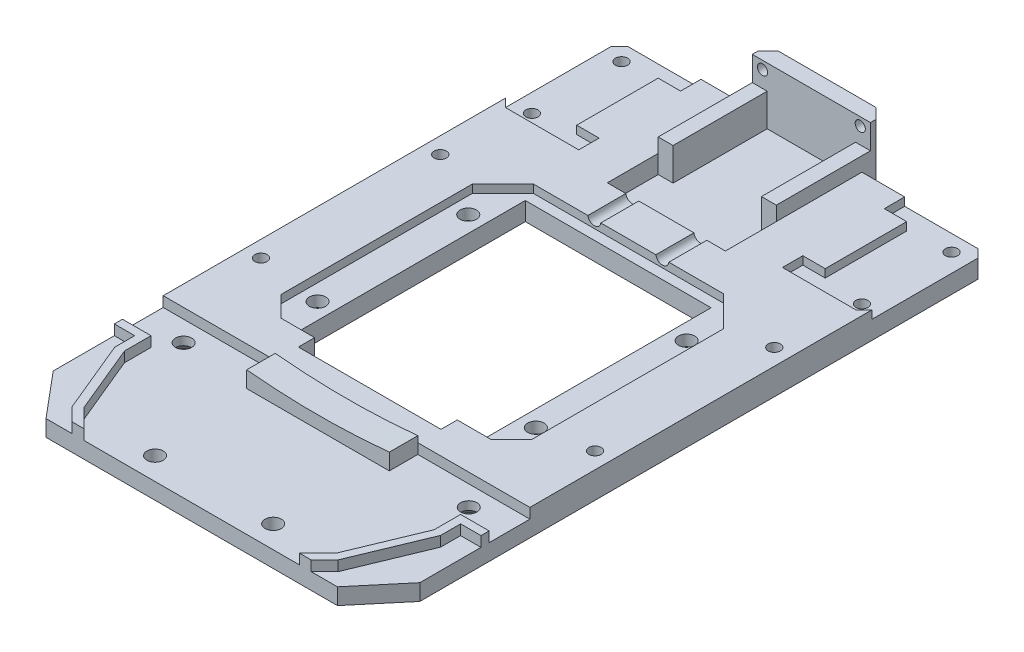
from build123d import *
from OCP.BRepFilletAPI import BRepFilletAPI_MakeChamfer

# Parameters (mm, degrees)
SKETCH1_W                                       = 90
SKETCH1_H                                       = 150
BOSS_EXTRUDE1_DEPTH                             = 6.5
CSK_FOR_M4_FLAT_HEAD_MACHINE_SCREW1_D           = 4
CSK_FOR_M4_FLAT_HEAD_MACHINE_SCREW1_DEPTH       = 38.798278762
CSK_FOR_M4_FLAT_HEAD_MACHINE_SCREW1_CSINK_D     = 7.9
CSK_FOR_M4_FLAT_HEAD_MACHINE_SCREW1_CSINK_ANGLE = 90
CSK_FOR_M4_FLAT_HEAD_MACHINE_SCREW1_TIP         = 1.201721238
SKETCH7_W                                       = 21.7
SKETCH7_H                                       = 24.512560893
CUT_EXTRUDE4_DEPTH                              = 4.5
CUT_EXTRUDE8_DEPTH                              = 88.705473033
CUT_EXTRUDE8_DEPTH_BACK                         = 88.705473033
CUT_EXTRUDE9_DEPTH                              = 88.705473033
CUT_EXTRUDE9_DEPTH_BACK                         = 88.705473033
SKETCH12_W                                      = 45.6
SKETCH12_H                                      = 57
CUT_EXTRUDE11_DEPTH                             = 88.705473033
CUT_EXTRUDE11_DEPTH_BACK                        = 2
CUT_EXTRUDE12_DEPTH                             = 2.5
CSK_FOR_M4_SFHCS1_AT_2_COUNT                    = 2
CSK_FOR_M4_SFHCS1_AT_2_PITCH                    = 37
CSK_FOR_M4_SFHCS1_AT_3_COUNT                    = 2
CSK_FOR_M4_SFHCS1_AT_3_PITCH                    = 65.130330876
CSK_FOR_M4_SFHCS1_AT_4_COUNT                    = 2
CSK_FOR_M4_SFHCS1_AT_4_PITCH                    = 53.6
SKETCH17_W                                      = 35
SKETCH17_H                                      = 7
BOSS_EXTRUDE2_DEPTH                             = 4
CUT_EXTRUDE13_DEPTH                             = 88.705473033
CUT_EXTRUDE13_DEPTH_BACK                        = 88.705473033
SKETCH18_W                                      = 35
SKETCH18_H                                      = 4
CUT_EXTRUDE14_DEPTH                             = 2
CSK_FOR_M3_SFHCS1_AT_2_COUNT                    = 2
CSK_FOR_M3_SFHCS1_AT_2_PITCH                    = 22
CSK_FOR_M3_SFHCS1_AT_3_COUNT                    = 2
CSK_FOR_M3_SFHCS1_AT_3_PITCH                    = 83.934498271
CSK_FOR_M3_SFHCS1_AT_4_COUNT                    = 2
CSK_FOR_M3_SFHCS1_AT_4_PITCH                    = 81
CSK_FOR_M3_SFHCS2_AT_2_COUNT                    = 2
CSK_FOR_M3_SFHCS2_AT_2_PITCH                    = 44
CSK_FOR_M3_SFHCS2_AT_3_COUNT                    = 2
CSK_FOR_M3_SFHCS2_AT_3_PITCH                    = 82
CSK_FOR_M3_SFHCS2_AT_4_COUNT                    = 2
CSK_FOR_M3_SFHCS2_AT_4_PITCH                    = 93.059120993
SKETCH24_W                                      = 29
SKETCH24_H                                      = 4.5
CUT_EXTRUDE15_DEPTH                             = 2
CSK_FOR_M4_SFHCS2_AT_2_COUNT                    = 2
CSK_FOR_M4_SFHCS2_AT_2_PITCH                    = 29
CHAMFER1_SIZE                                   = 2
SKETCH27_W                                      = 29
SKETCH27_H                                      = 12
BOSS_EXTRUDE3_DEPTH                             = 2
SKETCH28_W                                      = 3.65
SKETCH28_H                                      = 8
SKETCH28_H_2                                    = 2
BOSS_EXTRUDE4_DEPTH                             = 21
SKETCH29_R                                      = 1.6
CUT_EXTRUDE16_DEPTH                             = 9.323922895
BOSS_EXTRUDE5_DEPTH                             = 1
BOSS_EXTRUDE9_DEPTH                             = 1.5
BOSS_EXTRUDE10_DEPTH                            = 5
SKETCH36_W                                      = 21.7
SKETCH36_H                                      = 3.9
BOSS_EXTRUDE11_DEPTH                            = 8
CHAMFER4_SIZE                                   = 2.5
BOSS_EXTRUDE12_DEPTH                            = 6
F_1_0MM_DOWEL_HOLE1_D                           = 2.5
F_1_0MM_DOWEL_HOLE1_DEPTH                       = 5
F_1_0MM_DOWEL_HOLE1_TIP                         = 0.751075774
CHAMFER5_SIZE                                   = 11
CHAMFER5_SIZE2                                  = 9.230095943
CUT_EXTRUDE19_DEPTH                             = 9.5
CUT_EXTRUDE18_DEPTH                             = 14


with BuildPart() as part:
    # Sketch1 → Boss-Extrude1 (new body)
    with BuildSketch(Plane(origin=(0, 0, 0), x_dir=(1, 0, 0), z_dir=(0, 1, 0))):
        Rectangle(SKETCH1_W, SKETCH1_H)
    extrude(amount=BOSS_EXTRUDE1_DEPTH)

    # CSK for M4 Flat Head Machine Screw1
    with Locations(Plane(origin=(-695.683007616, 0, -1338.247292614), x_dir=(-1, 0, 0), z_dir=(0, -1, 0))):
        with Locations((-730.683007616, -1380.247292614), (-660.683007616, -1380.247292614)):
            CounterSinkHole(CSK_FOR_M4_FLAT_HEAD_MACHINE_SCREW1_D / 2, CSK_FOR_M4_FLAT_HEAD_MACHINE_SCREW1_CSINK_D / 2, depth=CSK_FOR_M4_FLAT_HEAD_MACHINE_SCREW1_DEPTH, counter_sink_angle=CSK_FOR_M4_FLAT_HEAD_MACHINE_SCREW1_CSINK_ANGLE)
            with Locations((0, 0, -(CSK_FOR_M4_FLAT_HEAD_MACHINE_SCREW1_DEPTH + CSK_FOR_M4_FLAT_HEAD_MACHINE_SCREW1_TIP / 2))):  # 118° drill point
                Cone(0, CSK_FOR_M4_FLAT_HEAD_MACHINE_SCREW1_D / 2, CSK_FOR_M4_FLAT_HEAD_MACHINE_SCREW1_TIP, mode=Mode.SUBTRACT)

    # Sketch7 → Cut-Extrude4 (cut)
    with BuildSketch(Plane(origin=(0, 6.5, 0), x_dir=(1, 0, 0), z_dir=(0, 1, 0))):
        with Locations((0, 62.743719554)):
            Rectangle(SKETCH7_W, SKETCH7_H)
    extrude(amount=-CUT_EXTRUDE4_DEPTH, mode=Mode.SUBTRACT)

    # Sketch11 → Cut-Extrude8 (cut, two sides: drawn at the far end of the back side and taken through both)
    with BuildSketch(Plane(origin=(0, 6.5, 0), x_dir=(1, 0, 0), z_dir=(0, 1, 0)).offset(-CUT_EXTRUDE8_DEPTH_BACK)):
        Polygon((-10.85, 75), (-14.5, 75), (-14.5, 42), (14.5, 42), (14.5, 75), (10.85, 75), (10.85, 50.487439107), (-10.85, 50.487439107), align=None)
    extrude(amount=CUT_EXTRUDE8_DEPTH + CUT_EXTRUDE8_DEPTH_BACK, mode=Mode.SUBTRACT)


with BuildPart() as cut_extrude8_piece_1:
    # of the separate pieces the step leaves, piece 1, a body of its own (cut_extrude8_pieces)
    add(part.part.solids().sort_by_distance((-45, 0, -75))[0])

    # Sketch12 → Cut-Extrude9 (cut, two sides: drawn at the far end of the back side and taken through both)
    with BuildSketch(Plane(origin=(0, 6.5, 0), x_dir=(1, 0, 0), z_dir=(0, 1, 0)).offset(-CUT_EXTRUDE9_DEPTH_BACK)):
        with Locations((0, 1.176077105)):
            Rectangle(SKETCH12_W, SKETCH12_H)
    extrude(amount=CUT_EXTRUDE9_DEPTH + CUT_EXTRUDE9_DEPTH_BACK, mode=Mode.SUBTRACT)

    # Sketch14 → Cut-Extrude11 (cut, two sides: drawn at the far end of the back side and taken through both)
    with BuildSketch(Plane(origin=(0, 6.5, 0), x_dir=(1, 0, 0), z_dir=(0, 1, 0)).offset(-CUT_EXTRUDE11_DEPTH_BACK)):
        Polygon((-22.8, -27.323922895), (-22.8, 29.676077105), (22.8, 29.676077105), (22.8, -27.323922895), (25.8, -27.323922895), (30.8, -22.323922895), (30.8, 24.676077105), (23.3, 32.176077105), (-23.3, 32.176077105), (-30.8, 24.676077105), (-30.8, -22.323922895), (-25.8, -27.323922895), align=None)
    extrude(amount=CUT_EXTRUDE11_DEPTH + CUT_EXTRUDE11_DEPTH_BACK, mode=Mode.SUBTRACT)

    # Sketch2 → Cut-Extrude12 (cut)
    with BuildSketch(Plane(origin=(0, 6.5, 0), x_dir=(1, 0, 0), z_dir=(0, 1, 0))):
        Polygon((-38, -47), (-45, -47), (-45, -37), (45, -37), (45, -47), (38, -47), (38, -53.5), (30.928932188, -70.571067812), (26.5, -75), (-26.5, -75), (-30.928932188, -70.571067812), (-38, -53.5), align=None)
        Polygon((-32.624450318, -71.703976807), (-29.328427125, -75), (-45, -75), (-45, -49), (-40, -49), (-40, -53.897824735), align=None)
        Polygon((29.328427125, -75), (32.624450318, -71.703976807), (40, -53.897824735), (40, -49), (45, -49), (45, -75), align=None)
    extrude(amount=-CUT_EXTRUDE12_DEPTH, mode=Mode.SUBTRACT)

    # Sketch16 → CSK for M4 SFHCS1 (revolve, cut)
    with BuildSketch(Plane(origin=(-26.8, 0, 17.323922895), x_dir=(0, 0, -1), z_dir=(1, 0, 0))):
        Polygon((0, 0), (0, 26.701721238), (2, 25.5), (2, 1.8), (3.8, 0), align=None)
    csk_for_m4_sfhcs1 = revolve(axis=Axis((-26.8, -6.35, 17.323922895), (0, 1, 0)), mode=Mode.SUBTRACT)

    # CSK for M4 SFHCS1 at 2: CSK for M4 SFHCS1 ×2
    with Locations(*[(0, 0, -i * CSK_FOR_M4_SFHCS1_AT_2_PITCH) for i in range(1, CSK_FOR_M4_SFHCS1_AT_2_COUNT)]):
        add(csk_for_m4_sfhcs1, mode=Mode.SUBTRACT)

    # CSK for M4 SFHCS1 at 3: CSK for M4 SFHCS1 ×2
    with Locations(*[Vector(0.8229652648649476, 0, -0.5680916940299047) * (i * CSK_FOR_M4_SFHCS1_AT_3_PITCH) for i in range(1, CSK_FOR_M4_SFHCS1_AT_3_COUNT)]):
        add(csk_for_m4_sfhcs1, mode=Mode.SUBTRACT)

    # CSK for M4 SFHCS1 at 4: CSK for M4 SFHCS1 ×2
    with Locations(*[(i * CSK_FOR_M4_SFHCS1_AT_4_PITCH, 0, 0) for i in range(1, CSK_FOR_M4_SFHCS1_AT_4_COUNT)]):
        add(csk_for_m4_sfhcs1, mode=Mode.SUBTRACT)

    # Sketch17 → Boss-Extrude2 (add)
    with BuildSketch(Plane(origin=(0, 4, 0), x_dir=(1, 0, 0), z_dir=(0, 1, 0))):
        with Locations((0, -40.5)):
            Rectangle(SKETCH17_W, SKETCH17_H)
    extrude(amount=BOSS_EXTRUDE2_DEPTH)

    # Sketch18 → Cut-Extrude13 (cut, two sides: drawn at the far end of the back side and taken through both)
    with BuildSketch(Plane(origin=(0, 6.5, 0), x_dir=(1, 0, 0), z_dir=(0, 1, 0)).offset(-CUT_EXTRUDE13_DEPTH_BACK)):
        with Locations((0, -29.323922895)):
            Rectangle(SKETCH18_W, SKETCH18_H)
    extrude(amount=CUT_EXTRUDE13_DEPTH + CUT_EXTRUDE13_DEPTH_BACK, mode=Mode.SUBTRACT)

    # Sketch19 → Cut-Extrude14 (cut)
    with BuildSketch(Plane(origin=(0, 6.5, 0), x_dir=(1, 0, 0), z_dir=(0, 1, 0))):
        Polygon((25, 70), (30.5, 70), (30.5, 50), (25, 50), (25, 45), (43, 45), (45, 47), (45, 75), (25, 75), align=None)
        Polygon((-25, 50), (-30.5, 50), (-30.5, 70), (-25, 70), (-25, 75), (-45, 75), (-45, 47), (-43, 45), (-25, 45), align=None)
    extrude(amount=-CUT_EXTRUDE14_DEPTH, mode=Mode.SUBTRACT)

    # Sketch21 → CSK for M3 SFHCS1 (revolve, cut)
    with BuildSketch(Plane(origin=(40.5, 0, -71), x_dir=(0, 0, -1), z_dir=(1, 0, 0))):
        Polygon((0, 0), (0, 5.901290929), (1.5, 5), (1.5, 1.86), (3.36, 0), align=None)
    csk_for_m3_sfhcs1 = revolve(axis=Axis((40.5, -6.35, -71), (0, 1, 0)), mode=Mode.SUBTRACT)

    # CSK for M3 SFHCS1 at 2: CSK for M3 SFHCS1 ×2
    with Locations(*[(0, 0, i * CSK_FOR_M3_SFHCS1_AT_2_PITCH) for i in range(1, CSK_FOR_M3_SFHCS1_AT_2_COUNT)]):
        add(csk_for_m3_sfhcs1, mode=Mode.SUBTRACT)

    # CSK for M3 SFHCS1 at 3: CSK for M3 SFHCS1 ×2
    with Locations(*[Vector(-0.9650382342013949, 0, 0.2621091500300089) * (i * CSK_FOR_M3_SFHCS1_AT_3_PITCH) for i in range(1, CSK_FOR_M3_SFHCS1_AT_3_COUNT)]):
        add(csk_for_m3_sfhcs1, mode=Mode.SUBTRACT)

    # CSK for M3 SFHCS1 at 4: CSK for M3 SFHCS1 ×2
    with Locations(*[(-i * CSK_FOR_M3_SFHCS1_AT_4_PITCH, 0, 0) for i in range(1, CSK_FOR_M3_SFHCS1_AT_4_COUNT)]):
        add(csk_for_m3_sfhcs1, mode=Mode.SUBTRACT)

    # Sketch23 → CSK for M3 SFHCS2 (revolve, cut)
    with BuildSketch(Plane(origin=(-41, 0, 17), x_dir=(0, 0, -1), z_dir=(1, 0, 0))):
        Polygon((0, 0), (0, 10.901290929), (1.5, 10), (1.5, 1.7), (3.2, 0), align=None)
    csk_for_m3_sfhcs2 = revolve(axis=Axis((-41, -6.35, 17), (0, 1, 0)), mode=Mode.SUBTRACT)

    # CSK for M3 SFHCS2 at 2: CSK for M3 SFHCS2 ×2
    with Locations(*[(0, 0, -i * CSK_FOR_M3_SFHCS2_AT_2_PITCH) for i in range(1, CSK_FOR_M3_SFHCS2_AT_2_COUNT)]):
        add(csk_for_m3_sfhcs2, mode=Mode.SUBTRACT)

    # CSK for M3 SFHCS2 at 3: CSK for M3 SFHCS2 ×2
    with Locations(*[(i * CSK_FOR_M3_SFHCS2_AT_3_PITCH, 0, 0) for i in range(1, CSK_FOR_M3_SFHCS2_AT_3_COUNT)]):
        add(csk_for_m3_sfhcs2, mode=Mode.SUBTRACT)

    # CSK for M3 SFHCS2 at 4: CSK for M3 SFHCS2 ×2
    with Locations(*[Vector(0.8811602680635651, 0, -0.4728177048146) * (i * CSK_FOR_M3_SFHCS2_AT_4_PITCH) for i in range(1, CSK_FOR_M3_SFHCS2_AT_4_COUNT)]):
        add(csk_for_m3_sfhcs2, mode=Mode.SUBTRACT)

    # Sketch24 → Cut-Extrude15 (cut)
    with BuildSketch(Plane(origin=(0, 0, -42), x_dir=(-1, 0, 0), z_dir=(0, 0, -1))):
        with Locations((0, 4.25)):
            Rectangle(SKETCH24_W, SKETCH24_H)
    extrude(amount=-CUT_EXTRUDE15_DEPTH, mode=Mode.SUBTRACT)

    # Sketch26 → CSK for M4 SFHCS2 (revolve, cut)
    with BuildSketch(Plane(origin=(-14.5, 11, 69.5), x_dir=(0, 0, 1), z_dir=(1, 0, 0))):
        Polygon((0, 0), (0, 12.201721238), (2, 11), (2, 1.8), (3.8, 0), align=None)
    csk_for_m4_sfhcs2 = revolve(axis=Axis((-14.5, 17.35, 69.5), (0, -1, 0)), mode=Mode.SUBTRACT)

    # CSK for M4 SFHCS2 at 2: CSK for M4 SFHCS2 ×2
    with Locations(*[(i * CSK_FOR_M4_SFHCS2_AT_2_PITCH, 0, 0) for i in range(1, CSK_FOR_M4_SFHCS2_AT_2_COUNT)]):
        add(csk_for_m4_sfhcs2, mode=Mode.SUBTRACT)

    # Chamfer1
    chamfer1_edges = [cut_extrude8_piece_1.edges().sort_by_distance(p)[0] for p in [
        (45, 2.25, -75),
        (-45, 2.25, -75),
    ]]
    chamfer(chamfer1_edges, length=CHAMFER1_SIZE)

    # Sketch27 → Boss-Extrude3 (add)
    with BuildSketch(Plane.XZ):
        with Locations((0, -48)):
            Rectangle(SKETCH27_W, SKETCH27_H)
    extrude(amount=-BOSS_EXTRUDE3_DEPTH)


with BuildPart() as cut_extrude8_piece_2:
    # of the separate pieces the step leaves, piece 2, a body of its own (cut_extrude8_pieces)
    add(part.part.solids().sort_by_distance((10.85, 0, -75))[0])

    # Combine1: union Cut-Extrude8 piece 1
    add(cut_extrude8_piece_1.part)

    # Sketch28 → Boss-Extrude4 (add)
    with BuildSketch(Plane(origin=(0, 0, -54), x_dir=(-1, 0, 0), z_dir=(0, 0, -1))):
        with Locations((-12.675, 6)):
            Rectangle(SKETCH28_W, SKETCH28_H)
        with Locations((12.675, 1)):
            Rectangle(SKETCH28_W, SKETCH28_H_2)
        with Locations((12.675, 6)):
            Rectangle(SKETCH28_W, SKETCH28_H)
        with Locations((-12.675, 1)):
            Rectangle(SKETCH28_W, SKETCH28_H_2)
    extrude(amount=BOSS_EXTRUDE4_DEPTH)

    # Sketch29 → Cut-Extrude16 (cut)
    with BuildSketch(Plane.XY.offset(-32.176077105)):
        with BuildLine():
            ThreePointArc((9.95, 6.7), (8.24980334, 8.296859615), (6.762549213, 6.5))
            Line((6.762549213, 6.5), (7.116103732, 6.5))
            ThreePointArc((7.116103732, 6.5), (8.249676361, 7.945967563), (9.6, 6.7))
            ThreePointArc((9.6, 6.7), (9.595967563, 6.599676361), (9.583896268, 6.5))
            Line((9.583896268, 6.5), (9.937450787, 6.5))
            ThreePointArc((9.937450787, 6.5), (9.946859615, 6.59980334), (9.95, 6.7))
        make_face()
        with BuildLine():
            Line((7.116103732, 6.5), (6.762549213, 6.5))
            ThreePointArc((6.762549213, 6.5), (8.35, 5.1), (9.937450787, 6.5))
            Line((9.937450787, 6.5), (9.583896268, 6.5))
            ThreePointArc((9.583896268, 6.5), (8.35, 5.45), (7.116103732, 6.5))
        make_face()
        with BuildLine():
            ThreePointArc((9.95, 6.7), (8.24980334, 8.296859615), (6.762549213, 6.5))
            Line((6.762549213, 6.5), (7.116103732, 6.5))
            ThreePointArc((7.116103732, 6.5), (8.249676361, 7.945967563), (9.6, 6.7))
            ThreePointArc((9.6, 6.7), (9.595967563, 6.599676361), (9.583896268, 6.5))
            Line((9.583896268, 6.5), (9.937450787, 6.5))
            ThreePointArc((9.937450787, 6.5), (9.946859615, 6.59980334), (9.95, 6.7))
        make_face()
        with BuildLine():
            Line((7.116103732, 6.5), (6.762549213, 6.5))
            ThreePointArc((6.762549213, 6.5), (8.35, 5.1), (9.937450787, 6.5))
            Line((9.937450787, 6.5), (9.583896268, 6.5))
            ThreePointArc((9.583896268, 6.5), (8.35, 5.45), (7.116103732, 6.5))
        make_face()
        with BuildLine():
            Line((9.583896268, 6.5), (7.116103732, 6.5))
            ThreePointArc((7.116103732, 6.5), (8.35, 5.45), (9.583896268, 6.5))
        make_face()
        with BuildLine():
            ThreePointArc((9.6, 6.7), (8.249676361, 7.945967563), (7.116103732, 6.5))
            Line((7.116103732, 6.5), (9.583896268, 6.5))
            ThreePointArc((9.583896268, 6.5), (9.595967563, 6.599676361), (9.6, 6.7))
        make_face()
        with BuildLine():
            Line((9.583896268, 6.5), (7.116103732, 6.5))
            ThreePointArc((7.116103732, 6.5), (8.35, 5.45), (9.583896268, 6.5))
        make_face()
        with BuildLine():
            ThreePointArc((9.6, 6.7), (8.249676361, 7.945967563), (7.116103732, 6.5))
            Line((7.116103732, 6.5), (9.583896268, 6.5))
            ThreePointArc((9.583896268, 6.5), (9.595967563, 6.599676361), (9.6, 6.7))
        make_face()
        with Locations((-8.35, 6.7)):
            Circle(SKETCH29_R)
    extrude(amount=-CUT_EXTRUDE16_DEPTH, mode=Mode.SUBTRACT)

    # Sketch30 → Boss-Extrude5 (add)
    with BuildSketch(Plane(origin=(0, 0, -75), x_dir=(-1, 0, 0), z_dir=(0, 0, -1))):
        Polygon((-14.5, 10), (-14.5, 0), (14.5, 0), (14.5, 10), (10.85, 10), (10.85, 2), (-10.85, 2), (-10.85, 10), align=None)
    extrude(amount=BOSS_EXTRUDE5_DEPTH)

    # Sketch34 → Boss-Extrude9 (add)
    with BuildSketch(Plane(origin=(0, 0, -40), x_dir=(-1, 0, 0), z_dir=(0, 0, -1))):
        with BuildLine():
            Line((6.762549213, 6.5), (-6.762549213, 6.5))
            ThreePointArc((-6.762549213, 6.5), (-8.35, 5.1), (-9.937450787, 6.5))
            Line((-9.937450787, 6.5), (-14.5, 6.5))
            Line((-14.5, 6.5), (-14.5, 2))
            Line((-14.5, 2), (14.5, 2))
            Line((14.5, 2), (14.5, 6.5))
            Line((14.5, 6.5), (9.937450787, 6.5))
            ThreePointArc((9.937450787, 6.5), (8.35, 5.1), (6.762549213, 6.5))
        make_face()
    extrude(amount=BOSS_EXTRUDE9_DEPTH)

    # Sketch35 → Boss-Extrude10 (add)
    with BuildSketch(Plane(origin=(0, 0, -76), x_dir=(-1, 0, 0), z_dir=(0, 0, -1))):
        Polygon((-10.85, 10), (-14.5, 10), (-14.5, 0), (14.5, 0), (14.5, 10), (10.85, 10), (10.85, 2), (-10.85, 2), align=None)
    extrude(amount=BOSS_EXTRUDE10_DEPTH)

    # Sketch36 → Boss-Extrude11 (add)
    with BuildSketch(Plane(origin=(0, 2, 0), x_dir=(1, 0, 0), z_dir=(0, 1, 0))):
        with Locations((0, 79.05)):
            Rectangle(SKETCH36_W, SKETCH36_H)
    extrude(amount=BOSS_EXTRUDE11_DEPTH)

    # Chamfer4
    chamfer4_edges = [cut_extrude8_piece_2.edges().sort_by_distance(p)[0] for p in [
        (14.5, 5, -81),
        (-14.5, 5, -81),
    ]]
    chamfer(chamfer4_edges, length=CHAMFER4_SIZE)

    # Sketch37 → Boss-Extrude12 (add)
    with BuildSketch(Plane(origin=(0, 10, 0), x_dir=(1, 0, 0), z_dir=(0, 1, 0))):
        Polygon((-10.85, 77.1), (-15.9, 77.1), (-12, 81), (12, 81), (15.9, 77.1), align=None)
    extrude(amount=BOSS_EXTRUDE12_DEPTH)

    # Ø1.0mm Dowel Hole1
    with Locations(Plane(origin=(0, 0, -81), x_dir=(-1, 0, 0), z_dir=(0, 0, -1))):
        with Locations((-12, 14), (12, 14)):
            Hole(F_1_0MM_DOWEL_HOLE1_D / 2, depth=F_1_0MM_DOWEL_HOLE1_DEPTH)
            with Locations((0, 0, -(F_1_0MM_DOWEL_HOLE1_DEPTH + F_1_0MM_DOWEL_HOLE1_TIP / 2))):  # 118° drill point
                Cone(0, F_1_0MM_DOWEL_HOLE1_D / 2, F_1_0MM_DOWEL_HOLE1_TIP, mode=Mode.SUBTRACT)

    # Chamfer5: one chamfer whose edges measure the first distance from different faces: ONE call of the kernel's chamfer builder (chamfer() names one face for all edges)
    chamfer5_edges_1 = [cut_extrude8_piece_2.edges().sort_by_distance(p)[0] for p in [
        (45, 2, 75),
    ]]
    chamfer5_side_1 = [cut_extrude8_piece_2.faces().sort_by_distance(p)[0] for p in [
        (45, 2.887804878, -1.217073171),
    ]]
    chamfer5_edges_2 = [cut_extrude8_piece_2.edges().sort_by_distance(p)[0] for p in [
        (-45, 2, 75),
    ]]
    chamfer5_side_2 = [cut_extrude8_piece_2.faces().sort_by_distance(p)[0] for p in [
        (-45, 2.887804878, -1.217073171),
    ]]
    chamfer5 = BRepFilletAPI_MakeChamfer(cut_extrude8_piece_2.part.solid().wrapped)
    for e in chamfer5_edges_1:
        chamfer5.Add(CHAMFER5_SIZE, CHAMFER5_SIZE2, e.wrapped, chamfer5_side_1[0].wrapped)  # the first distance lies on this face
    for e in chamfer5_edges_2:
        chamfer5.Add(CHAMFER5_SIZE, CHAMFER5_SIZE2, e.wrapped, chamfer5_side_2[0].wrapped)  # the first distance lies on this face
    add(Compound.cast(chamfer5.Shape()), mode=Mode.REPLACE)

    # Sketch42 → Cut-Extrude19 (cut)
    with BuildSketch(Plane(origin=(0, 0, 37), x_dir=(-1, 0, 0), z_dir=(0, 0, -1))):
        with BuildLine():
            Line((-17.5, 8), (17.5, 8))
            ThreePointArc((17.5, 8), (0, 7.133922251), (-17.5, 8))
        make_face()
    extrude(amount=-CUT_EXTRUDE19_DEPTH, mode=Mode.SUBTRACT)

    # Sketch41 → Cut-Extrude18 (cut)
    with BuildSketch(Plane.XZ.offset(-10)):
        Polygon((14.5, -77.1), (14.5, -78.5), (15.9, -77.1), align=None)
        Polygon((-15.9, -77.1), (-14.5, -78.5), (-14.5, -77.1), align=None)
    extrude(amount=-CUT_EXTRUDE18_DEPTH, mode=Mode.SUBTRACT)


solid = cut_extrude8_piece_2.part
